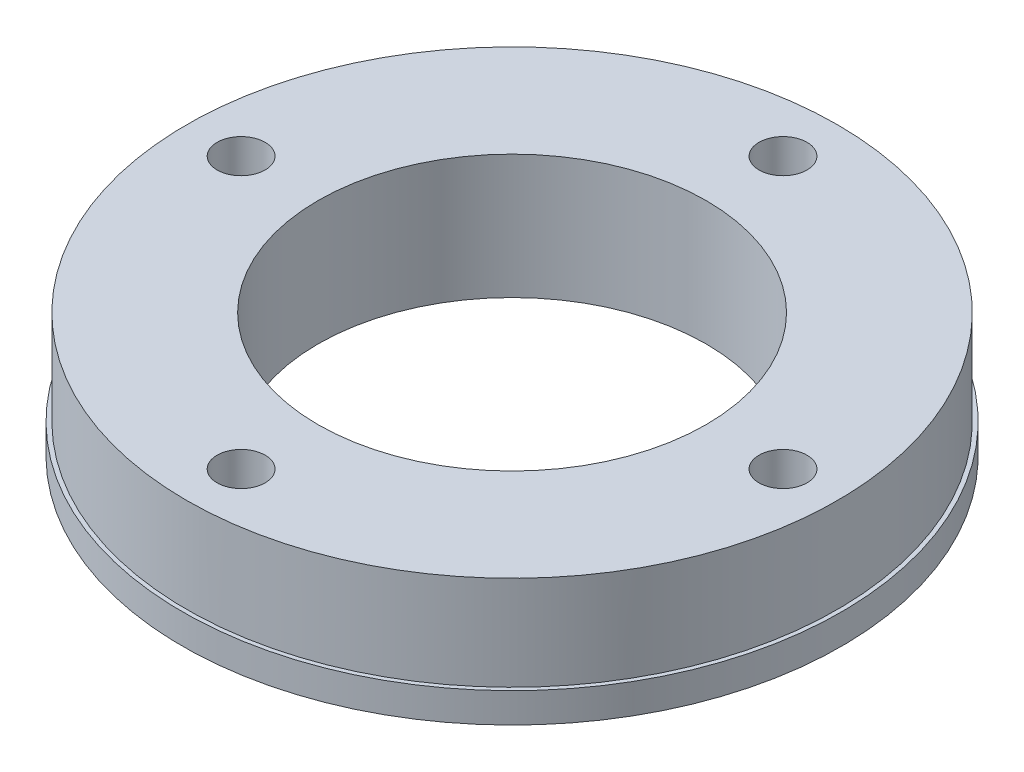
from build123d import *

# Parameters (mm, degrees)
SKETCH1_R      = 25.273
SKETCH1_R_2    = 14.88313
SKETCH1_R_3    = 1.8415
EXTRUDE1_DEPTH = 9.525
SKETCH2_W      = 5.0939162
SKETCH2_H      = 11.293845459


with BuildPart() as part:
    # Sketch1 → Extrude1 (new body)
    with BuildSketch(Plane(origin=(0, 0, 0), x_dir=(1, 0, 0), z_dir=(0, 1, 0))):
        with Locations(Location((0, 0, 0), (0, 0, 90))):
            Circle(SKETCH1_R)
        with Locations(Location((0, 0, 0), (0, 0, 90))):
            Circle(SKETCH1_R_2, mode=Mode.SUBTRACT)
        with Locations(Location((0, 20.7772, 0), (0, 0, 90))):
            Circle(SKETCH1_R_3, mode=Mode.SUBTRACT)
        with Locations(Location((0, -20.7772, 0), (0, 0, 90))):
            Circle(SKETCH1_R_3, mode=Mode.SUBTRACT)
        with Locations(Location((20.7772, 0, 0), (0, 0, 90))):
            Circle(SKETCH1_R_3, mode=Mode.SUBTRACT)
        with Locations(Location((-20.7772, 0, 0), (0, 0, 90))):
            Circle(SKETCH1_R_3, mode=Mode.SUBTRACT)
    extrude(amount=EXTRUDE1_DEPTH)

    # Sketch2 → Cut-Revolve1 (revolve, cut)
    with BuildSketch(Plane(origin=(0, 0, 0), x_dir=(0, 0, -1), z_dir=(1, 0, 0)), mode=Mode.PRIVATE) as cut_revolve1_sk:
        with Locations((-27.5024581, 7.93292273)):
            Rectangle(SKETCH2_W, SKETCH2_H)
    revolve(cut_revolve1_sk.sketch.rotate(Axis((0, 0, 0), (0, 1, 0)), 180), axis=Axis((0, 0, 0), (0, 1, 0)), mode=Mode.SUBTRACT)


solid = part.part
